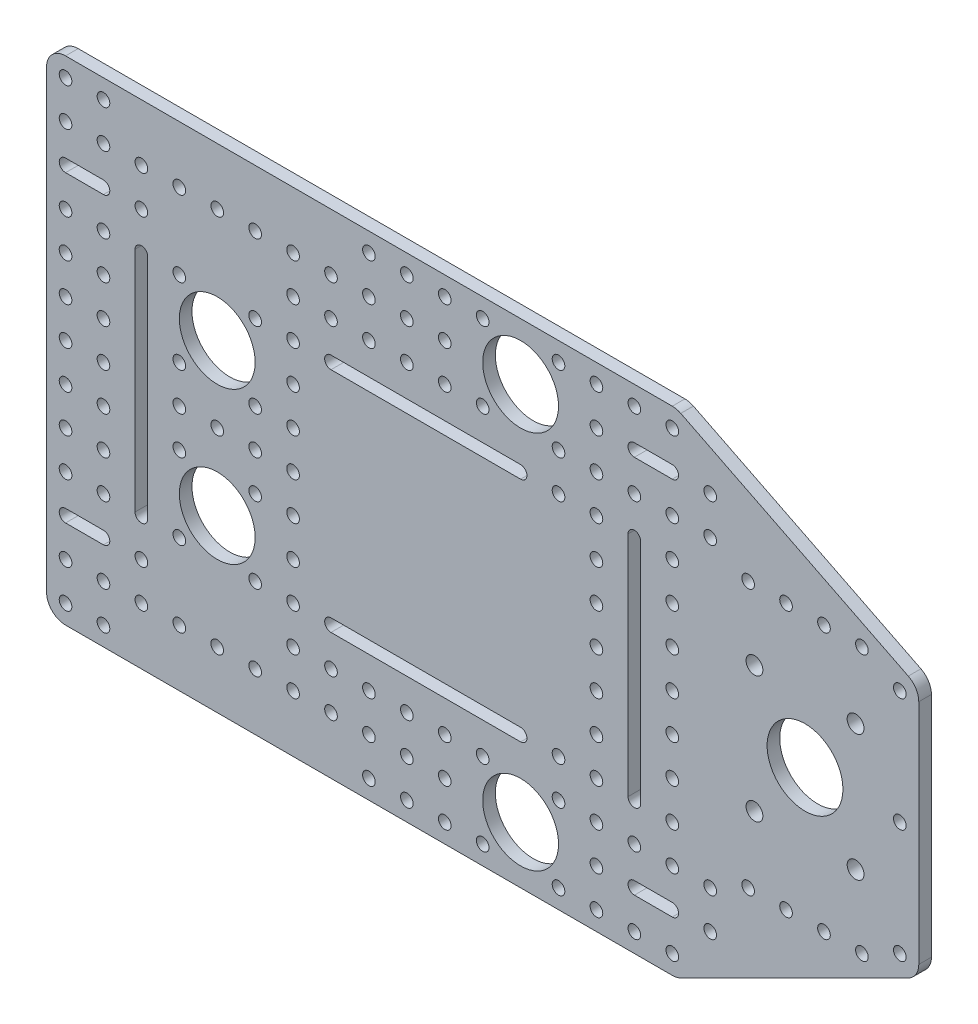
from build123d import *

# Parameters (mm, degrees)
MODEL_R                 = 1.5
MODEL_R_2               = 9
MODEL_R_3               = 2
SALIENTE_EXTRUIR1_DEPTH = 3


with BuildPart() as part:
    # Model → Saliente-Extruir1 (new body)
    with BuildSketch(Plane.XY):
        with BuildLine():
            Line((391.429131311, 507.742243614), (535.429131311, 507.742243614))
            ThreePointArc((535.429131311, 507.742243614), (536.463019453, 507.621864066), (537.441592491, 507.267165973))
            Line((537.441592491, 507.267165973), (591.441592491, 480.267165973))
            ThreePointArc((591.441592491, 480.267165973), (593.257059948, 478.608033618), (593.929131311, 476.242243614))
            Line((593.929131311, 476.242243614), (593.929131311, 422.242243614))
            ThreePointArc((593.929131311, 422.242243614), (593.257059948, 419.876453609), (591.441592491, 418.217321254))
            Line((591.441592491, 418.217321254), (537.441592491, 391.217321254))
            ThreePointArc((537.441592491, 391.217321254), (536.463019453, 390.862623161), (535.429131311, 390.742243614))
            Line((535.429131311, 390.742243614), (391.429131311, 390.742243614))
            ThreePointArc((391.429131311, 390.742243614), (388.247150795, 392.060263099), (386.929131311, 395.242243614))
            Line((386.929131311, 395.242243614), (386.929131311, 503.242243614))
            ThreePointArc((386.929131311, 503.242243614), (388.247150795, 506.424224129), (391.429131311, 507.742243614))
        make_face()
        with Locations((391.429131311, 476.242243614)):
            Circle(MODEL_R, mode=Mode.SUBTRACT)
        with Locations((391.429131311, 467.242243614)):
            Circle(MODEL_R, mode=Mode.SUBTRACT)
        with Locations((391.429131311, 458.242243614)):
            Circle(MODEL_R, mode=Mode.SUBTRACT)
        with Locations((391.429131311, 449.242243614)):
            Circle(MODEL_R, mode=Mode.SUBTRACT)
        with Locations((391.429131311, 440.242243614)):
            Circle(MODEL_R, mode=Mode.SUBTRACT)
        with Locations((391.429131311, 431.242243614)):
            Circle(MODEL_R, mode=Mode.SUBTRACT)
        with Locations((391.429131311, 422.242243614)):
            Circle(MODEL_R, mode=Mode.SUBTRACT)
        with Locations((391.429131311, 404.242243614)):
            Circle(MODEL_R, mode=Mode.SUBTRACT)
        with Locations((391.429131311, 395.242243614)):
            Circle(MODEL_R, mode=Mode.SUBTRACT)
        with Locations((400.429131311, 476.242243614)):
            Circle(MODEL_R, mode=Mode.SUBTRACT)
        with Locations((400.429131311, 467.242243614)):
            Circle(MODEL_R, mode=Mode.SUBTRACT)
        with Locations((400.429131311, 458.242243614)):
            Circle(MODEL_R, mode=Mode.SUBTRACT)
        with Locations((400.429131311, 449.242243614)):
            Circle(MODEL_R, mode=Mode.SUBTRACT)
        with Locations((400.429131311, 440.242243614)):
            Circle(MODEL_R, mode=Mode.SUBTRACT)
        with Locations((400.429131311, 431.242243614)):
            Circle(MODEL_R, mode=Mode.SUBTRACT)
        with Locations((400.429131311, 422.242243614)):
            Circle(MODEL_R, mode=Mode.SUBTRACT)
        with Locations((400.429131311, 404.242243614)):
            Circle(MODEL_R, mode=Mode.SUBTRACT)
        with Locations((400.429131311, 395.242243614)):
            Circle(MODEL_R, mode=Mode.SUBTRACT)
        with Locations((409.429131311, 413.242243614)):
            Circle(MODEL_R, mode=Mode.SUBTRACT)
        with Locations((409.429131311, 404.242243614)):
            Circle(MODEL_R, mode=Mode.SUBTRACT)
        with Locations((418.429131311, 476.242243614)):
            Circle(MODEL_R, mode=Mode.SUBTRACT)
        with Locations((418.429131311, 458.242243614)):
            Circle(MODEL_R, mode=Mode.SUBTRACT)
        with Locations((418.429131311, 449.242243614)):
            Circle(MODEL_R, mode=Mode.SUBTRACT)
        with Locations((418.429131311, 440.242243614)):
            Circle(MODEL_R, mode=Mode.SUBTRACT)
        with Locations((418.429131311, 422.242243614)):
            Circle(MODEL_R, mode=Mode.SUBTRACT)
        with Locations((418.429131311, 404.242243614)):
            Circle(MODEL_R, mode=Mode.SUBTRACT)
        with Locations((427.429131311, 449.242243614)):
            Circle(MODEL_R, mode=Mode.SUBTRACT)
        with Locations((427.429131311, 404.242243614)):
            Circle(MODEL_R, mode=Mode.SUBTRACT)
        with Locations((436.429131311, 476.242243614)):
            Circle(MODEL_R, mode=Mode.SUBTRACT)
        with Locations((436.429131311, 458.242243614)):
            Circle(MODEL_R, mode=Mode.SUBTRACT)
        with Locations((436.429131311, 449.242243614)):
            Circle(MODEL_R, mode=Mode.SUBTRACT)
        with Locations((436.429131311, 440.242243614)):
            Circle(MODEL_R, mode=Mode.SUBTRACT)
        with Locations((436.429131311, 422.242243614)):
            Circle(MODEL_R, mode=Mode.SUBTRACT)
        with Locations((436.429131311, 404.242243614)):
            Circle(MODEL_R, mode=Mode.SUBTRACT)
        with Locations((445.429131311, 476.242243614)):
            Circle(MODEL_R, mode=Mode.SUBTRACT)
        with Locations((445.429131311, 467.242243614)):
            Circle(MODEL_R, mode=Mode.SUBTRACT)
        with Locations((445.429131311, 458.242243614)):
            Circle(MODEL_R, mode=Mode.SUBTRACT)
        with Locations((445.429131311, 449.242243614)):
            Circle(MODEL_R, mode=Mode.SUBTRACT)
        with Locations((445.429131311, 440.242243614)):
            Circle(MODEL_R, mode=Mode.SUBTRACT)
        with Locations((445.429131311, 431.242243614)):
            Circle(MODEL_R, mode=Mode.SUBTRACT)
        with Locations((445.429131311, 422.242243614)):
            Circle(MODEL_R, mode=Mode.SUBTRACT)
        with Locations((445.429131311, 413.242243614)):
            Circle(MODEL_R, mode=Mode.SUBTRACT)
        with Locations((445.429131311, 404.242243614)):
            Circle(MODEL_R, mode=Mode.SUBTRACT)
        with Locations((454.429131311, 413.242243614)):
            Circle(MODEL_R, mode=Mode.SUBTRACT)
        with Locations((454.429131311, 404.242243614)):
            Circle(MODEL_R, mode=Mode.SUBTRACT)
        with Locations((463.429131311, 413.242243614)):
            Circle(MODEL_R, mode=Mode.SUBTRACT)
        with Locations((463.429131311, 404.242243614)):
            Circle(MODEL_R, mode=Mode.SUBTRACT)
        with Locations((463.429131311, 395.242243614)):
            Circle(MODEL_R, mode=Mode.SUBTRACT)
        with Locations((472.429131311, 413.242243614)):
            Circle(MODEL_R, mode=Mode.SUBTRACT)
        with Locations((472.429131311, 404.242243614)):
            Circle(MODEL_R, mode=Mode.SUBTRACT)
        with Locations((472.429131311, 395.242243614)):
            Circle(MODEL_R, mode=Mode.SUBTRACT)
        with Locations((481.429131311, 413.242243614)):
            Circle(MODEL_R, mode=Mode.SUBTRACT)
        with Locations((481.429131311, 404.242243614)):
            Circle(MODEL_R, mode=Mode.SUBTRACT)
        with Locations((481.429131311, 395.242243614)):
            Circle(MODEL_R, mode=Mode.SUBTRACT)
        with Locations((490.429131311, 413.242243614)):
            Circle(MODEL_R, mode=Mode.SUBTRACT)
        with Locations((490.429131311, 395.242243614)):
            Circle(MODEL_R, mode=Mode.SUBTRACT)
        with Locations((508.429131311, 413.242243614)):
            Circle(MODEL_R, mode=Mode.SUBTRACT)
        with Locations((508.429131311, 395.242243614)):
            Circle(MODEL_R, mode=Mode.SUBTRACT)
        with Locations((544.429131311, 413.242243614)):
            Circle(MODEL_R, mode=Mode.SUBTRACT)
        with Locations((544.429131311, 404.242243614)):
            Circle(MODEL_R, mode=Mode.SUBTRACT)
        with Locations((553.429131311, 417.742243614)):
            Circle(MODEL_R, mode=Mode.SUBTRACT)
        with Locations((562.429131311, 417.742243614)):
            Circle(MODEL_R, mode=Mode.SUBTRACT)
        with Locations((571.429131311, 417.742243614)):
            Circle(MODEL_R, mode=Mode.SUBTRACT)
        with Locations((580.429131311, 417.742243614)):
            Circle(MODEL_R, mode=Mode.SUBTRACT)
        with Locations((589.429131311, 476.242243614)):
            Circle(MODEL_R, mode=Mode.SUBTRACT)
        with Locations((589.429131311, 449.242243614)):
            Circle(MODEL_R, mode=Mode.SUBTRACT)
        with Locations((589.429131311, 422.242243614)):
            Circle(MODEL_R, mode=Mode.SUBTRACT)
        with Locations((535.429131311, 476.242243614)):
            Circle(MODEL_R, mode=Mode.SUBTRACT)
        with Locations((535.429131311, 467.242243614)):
            Circle(MODEL_R, mode=Mode.SUBTRACT)
        with Locations((535.429131311, 458.242243614)):
            Circle(MODEL_R, mode=Mode.SUBTRACT)
        with Locations((535.429131311, 449.242243614)):
            Circle(MODEL_R, mode=Mode.SUBTRACT)
        with Locations((535.429131311, 440.242243614)):
            Circle(MODEL_R, mode=Mode.SUBTRACT)
        with Locations((535.429131311, 431.242243614)):
            Circle(MODEL_R, mode=Mode.SUBTRACT)
        with Locations((535.429131311, 422.242243614)):
            Circle(MODEL_R, mode=Mode.SUBTRACT)
        with Locations((535.429131311, 413.242243614)):
            Circle(MODEL_R, mode=Mode.SUBTRACT)
        with Locations((535.429131311, 395.242243614)):
            Circle(MODEL_R, mode=Mode.SUBTRACT)
        with Locations((391.429131311, 503.242243614)):
            Circle(MODEL_R, mode=Mode.SUBTRACT)
        with Locations((400.429131311, 503.242243614)):
            Circle(MODEL_R, mode=Mode.SUBTRACT)
        with Locations((409.429131311, 485.242243614)):
            Circle(MODEL_R, mode=Mode.SUBTRACT)
        with Locations((454.429131311, 485.242243614)):
            Circle(MODEL_R, mode=Mode.SUBTRACT)
        with Locations((463.429131311, 503.242243614)):
            Circle(MODEL_R, mode=Mode.SUBTRACT)
        with Locations((463.429131311, 485.242243614)):
            Circle(MODEL_R, mode=Mode.SUBTRACT)
        with Locations((472.429131311, 503.242243614)):
            Circle(MODEL_R, mode=Mode.SUBTRACT)
        with Locations((472.429131311, 485.242243614)):
            Circle(MODEL_R, mode=Mode.SUBTRACT)
        with Locations((481.429131311, 503.242243614)):
            Circle(MODEL_R, mode=Mode.SUBTRACT)
        with Locations((481.429131311, 485.242243614)):
            Circle(MODEL_R, mode=Mode.SUBTRACT)
        with Locations((490.429131311, 503.242243614)):
            Circle(MODEL_R, mode=Mode.SUBTRACT)
        with Locations((490.429131311, 485.242243614)):
            Circle(MODEL_R, mode=Mode.SUBTRACT)
        with Locations((508.429131311, 503.242243614)):
            Circle(MODEL_R, mode=Mode.SUBTRACT)
        with Locations((508.429131311, 485.242243614)):
            Circle(MODEL_R, mode=Mode.SUBTRACT)
        with Locations((544.429131311, 485.242243614)):
            Circle(MODEL_R, mode=Mode.SUBTRACT)
        with Locations((553.429131311, 480.742243614)):
            Circle(MODEL_R, mode=Mode.SUBTRACT)
        with Locations((562.429131311, 480.742243614)):
            Circle(MODEL_R, mode=Mode.SUBTRACT)
        with Locations((571.429131311, 480.742243614)):
            Circle(MODEL_R, mode=Mode.SUBTRACT)
        with Locations((580.429131311, 480.742243614)):
            Circle(MODEL_R, mode=Mode.SUBTRACT)
        with Locations((535.429131311, 503.242243614)):
            Circle(MODEL_R, mode=Mode.SUBTRACT)
        with Locations((535.429131311, 485.242243614)):
            Circle(MODEL_R, mode=Mode.SUBTRACT)
        with Locations((391.429131311, 494.242243614)):
            Circle(MODEL_R, mode=Mode.SUBTRACT)
        with Locations((400.429131311, 494.242243614)):
            Circle(MODEL_R, mode=Mode.SUBTRACT)
        with Locations((409.429131311, 494.242243614)):
            Circle(MODEL_R, mode=Mode.SUBTRACT)
        with Locations((418.429131311, 494.242243614)):
            Circle(MODEL_R, mode=Mode.SUBTRACT)
        with Locations((427.429131311, 494.242243614)):
            Circle(MODEL_R, mode=Mode.SUBTRACT)
        with Locations((436.429131311, 494.242243614)):
            Circle(MODEL_R, mode=Mode.SUBTRACT)
        with Locations((445.429131311, 494.242243614)):
            Circle(MODEL_R, mode=Mode.SUBTRACT)
        with Locations((454.429131311, 494.242243614)):
            Circle(MODEL_R, mode=Mode.SUBTRACT)
        with Locations((463.429131311, 494.242243614)):
            Circle(MODEL_R, mode=Mode.SUBTRACT)
        with Locations((472.429131311, 494.242243614)):
            Circle(MODEL_R, mode=Mode.SUBTRACT)
        with Locations((481.429131311, 494.242243614)):
            Circle(MODEL_R, mode=Mode.SUBTRACT)
        with Locations((544.429131311, 494.242243614)):
            Circle(MODEL_R, mode=Mode.SUBTRACT)
        with Locations((427.429131311, 467.242243614)):
            Circle(MODEL_R_2, mode=Mode.SUBTRACT)
        with Locations((427.429131311, 431.242243614)):
            Circle(MODEL_R_2, mode=Mode.SUBTRACT)
        with Locations((508.429131311, 476.242243614)):
            Circle(MODEL_R, mode=Mode.SUBTRACT)
        with Locations((508.429131311, 422.242243614)):
            Circle(MODEL_R, mode=Mode.SUBTRACT)
        with Locations((517.429131311, 476.242243614)):
            Circle(MODEL_R, mode=Mode.SUBTRACT)
        with Locations((517.429131311, 467.242243614)):
            Circle(MODEL_R, mode=Mode.SUBTRACT)
        with Locations((517.429131311, 458.242243614)):
            Circle(MODEL_R, mode=Mode.SUBTRACT)
        with Locations((517.429131311, 449.242243614)):
            Circle(MODEL_R, mode=Mode.SUBTRACT)
        with Locations((517.429131311, 440.242243614)):
            Circle(MODEL_R, mode=Mode.SUBTRACT)
        with Locations((517.429131311, 431.242243614)):
            Circle(MODEL_R, mode=Mode.SUBTRACT)
        with Locations((517.429131311, 422.242243614)):
            Circle(MODEL_R, mode=Mode.SUBTRACT)
        with Locations((517.429131311, 413.242243614)):
            Circle(MODEL_R, mode=Mode.SUBTRACT)
        with Locations((517.429131311, 404.242243614)):
            Circle(MODEL_R, mode=Mode.SUBTRACT)
        with Locations((517.429131311, 395.242243614)):
            Circle(MODEL_R, mode=Mode.SUBTRACT)
        with Locations((526.429131311, 413.242243614)):
            Circle(MODEL_R, mode=Mode.SUBTRACT)
        with Locations((526.429131311, 395.242243614)):
            Circle(MODEL_R, mode=Mode.SUBTRACT)
        with Locations((517.429131311, 503.242243614)):
            Circle(MODEL_R, mode=Mode.SUBTRACT)
        with Locations((517.429131311, 485.242243614)):
            Circle(MODEL_R, mode=Mode.SUBTRACT)
        with Locations((526.429131311, 503.242243614)):
            Circle(MODEL_R, mode=Mode.SUBTRACT)
        with Locations((526.429131311, 485.242243614)):
            Circle(MODEL_R, mode=Mode.SUBTRACT)
        with Locations((517.429131311, 494.242243614)):
            Circle(MODEL_R, mode=Mode.SUBTRACT)
        with Locations((445.429131311, 485.242243614)):
            Circle(MODEL_R, mode=Mode.SUBTRACT)
        with Locations((499.429131311, 494.242243614)):
            Circle(MODEL_R_2, mode=Mode.SUBTRACT)
        with Locations((499.429131311, 404.242243614)):
            Circle(MODEL_R_2, mode=Mode.SUBTRACT)
        with Locations((578.929131311, 434.242243614)):
            Circle(MODEL_R_3, mode=Mode.SUBTRACT)
        with Locations((578.929131311, 464.242243614)):
            Circle(MODEL_R_3, mode=Mode.SUBTRACT)
        with Locations((554.929131311, 464.242243614)):
            Circle(MODEL_R_3, mode=Mode.SUBTRACT)
        with Locations((554.929131311, 434.242243614)):
            Circle(MODEL_R_3, mode=Mode.SUBTRACT)
        with Locations((566.929131311, 449.242243614)):
            Circle(MODEL_R_2, mode=Mode.SUBTRACT)
        with BuildLine():
            Line((407.929131311, 476.242243614), (407.929131311, 422.242243614))
            ThreePointArc((407.929131311, 422.242243614), (409.429131311, 420.742243614), (410.929131311, 422.242243614))
            Line((410.929131311, 422.242243614), (410.929131311, 476.242243614))
            ThreePointArc((410.929131311, 476.242243614), (409.429131311, 477.742243614), (407.929131311, 476.242243614))
        make_face(mode=Mode.SUBTRACT)
        with BuildLine():
            Line((524.929131311, 476.242243614), (524.929131311, 422.242243614))
            ThreePointArc((524.929131311, 422.242243614), (526.429131311, 420.742243614), (527.929131311, 422.242243614))
            Line((527.929131311, 422.242243614), (527.929131311, 476.242243614))
            ThreePointArc((527.929131311, 476.242243614), (526.429131311, 477.742243614), (524.929131311, 476.242243614))
        make_face(mode=Mode.SUBTRACT)
        with BuildLine():
            Line((526.429131311, 495.742243614), (535.429131311, 495.742243614))
            ThreePointArc((535.429131311, 495.742243614), (536.929131311, 494.242243614), (535.429131311, 492.742243614))
            Line((535.429131311, 492.742243614), (526.429131311, 492.742243614))
            ThreePointArc((526.429131311, 492.742243614), (524.929131311, 494.242243614), (526.429131311, 495.742243614))
        make_face(mode=Mode.SUBTRACT)
        with BuildLine():
            Line((526.429131311, 405.742243614), (535.429131311, 405.742243614))
            ThreePointArc((535.429131311, 405.742243614), (536.929131311, 404.242243614), (535.429131311, 402.742243614))
            Line((535.429131311, 402.742243614), (526.429131311, 402.742243614))
            ThreePointArc((526.429131311, 402.742243614), (524.929131311, 404.242243614), (526.429131311, 405.742243614))
        make_face(mode=Mode.SUBTRACT)
        with BuildLine():
            Line((391.429131311, 486.742243614), (400.429131311, 486.742243614))
            ThreePointArc((400.429131311, 486.742243614), (401.929131311, 485.242243614), (400.429131311, 483.742243614))
            Line((400.429131311, 483.742243614), (391.429131311, 483.742243614))
            ThreePointArc((391.429131311, 483.742243614), (389.929131311, 485.242243614), (391.429131311, 486.742243614))
        make_face(mode=Mode.SUBTRACT)
        with BuildLine():
            Line((400.429131311, 414.742243614), (391.429131311, 414.742243614))
            ThreePointArc((391.429131311, 414.742243614), (389.929131311, 413.242243614), (391.429131311, 411.742243614))
            Line((391.429131311, 411.742243614), (400.429131311, 411.742243614))
            ThreePointArc((400.429131311, 411.742243614), (401.929131311, 413.242243614), (400.429131311, 414.742243614))
        make_face(mode=Mode.SUBTRACT)
        with BuildLine():
            Line((454.429131311, 474.742243614), (499.429131311, 474.742243614))
            ThreePointArc((499.429131311, 474.742243614), (500.929131311, 476.242243614), (499.429131311, 477.742243614))
            Line((499.429131311, 477.742243614), (454.429131311, 477.742243614))
            ThreePointArc((454.429131311, 477.742243614), (452.929131311, 476.242243614), (454.429131311, 474.742243614))
        make_face(mode=Mode.SUBTRACT)
        with BuildLine():
            Line((454.429131311, 420.742243614), (499.429131311, 420.742243614))
            ThreePointArc((499.429131311, 420.742243614), (500.929131311, 422.242243614), (499.429131311, 423.742243614))
            Line((499.429131311, 423.742243614), (454.429131311, 423.742243614))
            ThreePointArc((454.429131311, 423.742243614), (452.929131311, 422.242243614), (454.429131311, 420.742243614))
        make_face(mode=Mode.SUBTRACT)
    extrude(amount=SALIENTE_EXTRUIR1_DEPTH)


solid = part.part
